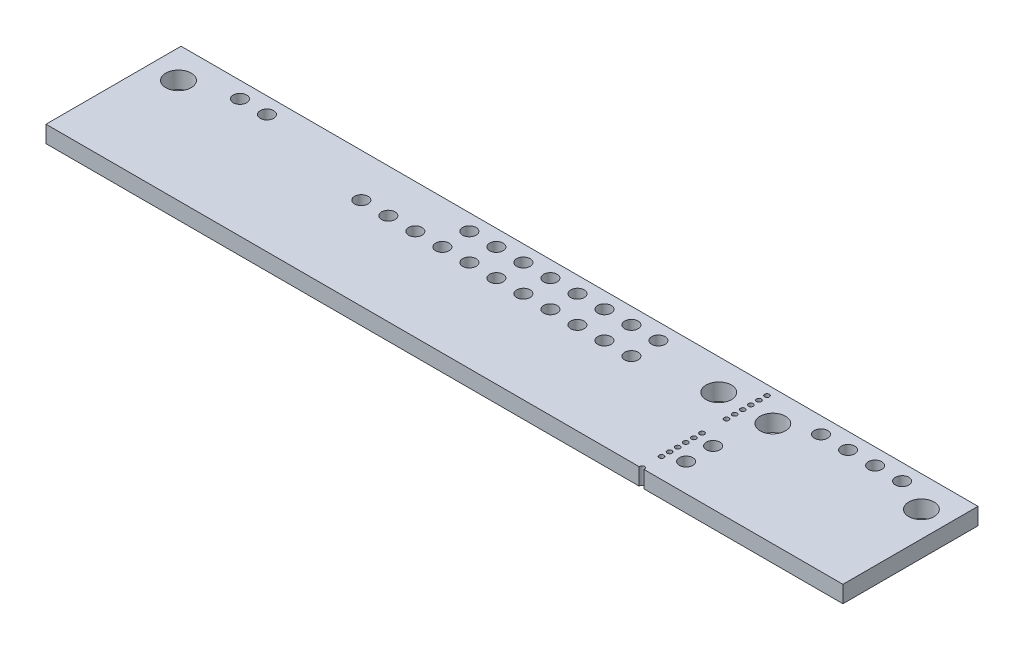
from build123d import *

# Parameters (mm, degrees)
SKETCH1_W           = 74.93
SKETCH1_H           = 12.7
BOSS_EXTRUDE1_DEPTH = 1.5875
CUT_EXTRUDE1_REACH  = 136.341
SKETCH2_R           = 1.1938
BOSS_EXTRUDE2_DEPTH = 1.6
SKETCH4_W           = 2.159
SKETCH4_H           = 1.27
CUT_EXTRUDE2_DEPTH  = 0.4
BOSS_EXTRUDE3_DEPTH = 3.4
SKETCH7_W           = 1.628437349
SKETCH7_H           = 1.286712751
SKETCH7_W_2         = 1.879951672
SKETCH7_H_2         = 1.278378213
SKETCH7_H_3         = 0.900698925
SKETCH7_H_4         = 1.3
CUT_EXTRUDE3_DEPTH  = 135.340813795
LPATTERN1_COUNT     = 8
LPATTERN1_PITCH     = 9.525
SKETCH8_R           = 0.63325759
SKETCH8_R_2         = 0.224218381
CUT_EXTRUDE4_DEPTH  = 1.5875


with BuildPart() as part:
    # Sketch1 → Boss-Extrude1 (new body)
    with BuildSketch(Plane(origin=(0, 0, 0), x_dir=(1, 0, 0), z_dir=(0, 1, 0))):
        with Locations((-95.31688982, 13.993647339)):
            Rectangle(SKETCH1_W, SKETCH1_H)
    extrude(amount=BOSS_EXTRUDE1_DEPTH)

    # Sketch2 → Cut-Extrude1 (cut, up to next)
    with BuildSketch(Plane(origin=(0, 1.5875, 0), x_dir=(1, 0, 0), z_dir=(0, 1, 0)), mode=Mode.PRIVATE) as cut_extrude1_sk1:
        with Locations(Location((-130.119440394, 17.438350152, 0), (0, 0, 270))):
            Circle(SKETCH2_R)
    cut_extrude1_tool1 = extrude(cut_extrude1_sk1.sketch, amount=-CUT_EXTRUDE1_REACH, mode=Mode.PRIVATE) & part.part
    # Sketch2 → Cut-Extrude1 (cut, up to next)
    with BuildSketch(Plane(origin=(0, 1.5875, 0), x_dir=(1, 0, 0), z_dir=(0, 1, 0)), mode=Mode.PRIVATE) as cut_extrude1_sk2:
        with Locations(Location((-79.319440394, 17.438350152, 0), (0, 0, 270))):
            Circle(SKETCH2_R)
    cut_extrude1_tool2 = extrude(cut_extrude1_sk2.sketch, amount=-CUT_EXTRUDE1_REACH, mode=Mode.PRIVATE) & part.part
    # Sketch2 → Cut-Extrude1 (cut, up to next)
    with BuildSketch(Plane(origin=(0, 1.5875, 0), x_dir=(1, 0, 0), z_dir=(0, 1, 0)), mode=Mode.PRIVATE) as cut_extrude1_sk3:
        with Locations(Location((-74.239440394, 17.438350152, 0), (0, 0, 270))):
            Circle(SKETCH2_R)
    cut_extrude1_tool3 = extrude(cut_extrude1_sk3.sketch, amount=-CUT_EXTRUDE1_REACH, mode=Mode.PRIVATE) & part.part
    # Sketch2 → Cut-Extrude1 (cut, up to next)
    with BuildSketch(Plane(origin=(0, 1.5875, 0), x_dir=(1, 0, 0), z_dir=(0, 1, 0)), mode=Mode.PRIVATE) as cut_extrude1_sk4:
        with Locations(Location((-60.269440394, 17.438350152, 0), (0, 0, 270))):
            Circle(SKETCH2_R)
    cut_extrude1_tool4 = extrude(cut_extrude1_sk4.sketch, amount=-CUT_EXTRUDE1_REACH, mode=Mode.PRIVATE) & part.part
    add(cut_extrude1_tool1.solids().sort_by_distance((-130.11944, 1.5875, -17.43835))[0], mode=Mode.SUBTRACT)
    add(cut_extrude1_tool2.solids().sort_by_distance((-79.31944, 1.5875, -17.43835))[0], mode=Mode.SUBTRACT)
    add(cut_extrude1_tool3.solids().sort_by_distance((-74.23944, 1.5875, -17.43835))[0], mode=Mode.SUBTRACT)
    add(cut_extrude1_tool4.solids().sort_by_distance((-60.26944, 1.5875, -17.43835))[0], mode=Mode.SUBTRACT)

    # Sketch3 → Boss-Extrude2 (add)
    with BuildSketch(Plane.XZ):
        Polygon((-127.911953378, -9.436207352), (-127.411953378, -9.936207352), (-127.411953378, -12.836207352), (-130.111953378, -12.836207352), (-130.111953378, -9.436207352), align=None)
    boss_extrude2 = extrude(amount=BOSS_EXTRUDE2_DEPTH)

    # Sketch4 → Cut-Extrude2 (cut)
    with BuildSketch(Plane.XZ.offset(1.6)):
        Polygon((-127.937602017, -9.74120725), (-127.683602017, -9.99520725), (-127.683602017, -11.01120725), (-129.842602017, -11.01120725), (-129.842602017, -9.74120725), align=None)
        with Locations((-128.763102017, -11.896207454)):
            Rectangle(SKETCH4_W, SKETCH4_H)
    cut_extrude2 = extrude(amount=-CUT_EXTRUDE2_DEPTH, mode=Mode.SUBTRACT)

    # Sketch5 → Boss-Extrude3 (add)
    with BuildSketch(Plane(origin=(0, 0, -12.836207352), x_dir=(-1, 0, 0), z_dir=(0, 0, -1))):
        Polygon((130.111953378, -0.702294734), (130.327423432, -0.702294734), (130.617423432, -0.2), (131.111953378, -0.2), (131.111953378, 0), (130.501953378, 0), (130.211953378, -0.502294734), (130.111953378, -0.502294734), align=None)
        Polygon((127.411953378, -0.502294734), (127.411953378, -0.702294734), (127.196483324, -0.702294734), (126.906483324, -0.2), (126.411953378, -0.2), (126.411953378, 0), (127.021953378, 0), (127.311953378, -0.502294734), align=None)
    boss_extrude3 = extrude(amount=-BOSS_EXTRUDE3_DEPTH)

    # Sketch7 → Cut-Extrude3 (cut, through all)
    with BuildSketch(Plane.XZ):
        with Locations((-130.926172053, -9.300850977)):
            Rectangle(SKETCH7_W, SKETCH7_H)
        with Locations((-126.471977542, -9.305018246)):
            Rectangle(SKETCH7_W_2, SKETCH7_H_2)
        with Locations((-130.926172053, -12.694556815)):
            Rectangle(SKETCH7_W, SKETCH7_H_3)
        with Locations((-126.471977542, -12.694556815)):
            Rectangle(SKETCH7_W_2, SKETCH7_H_3)
        with Locations((-130.926172053, -11.094207352)):
            Rectangle(SKETCH7_W, SKETCH7_H_4)
        with Locations((-126.471977542, -11.094207352)):
            Rectangle(SKETCH7_W_2, SKETCH7_H_4)
    cut_extrude3 = extrude(amount=CUT_EXTRUDE3_DEPTH, mode=Mode.SUBTRACT)

    # LPattern1: Boss-Extrude2, Cut-Extrude2, Boss-Extrude3, Cut-Extrude3 ×8
    with Locations(*[(i * LPATTERN1_PITCH, 0, 0) for i in range(1, LPATTERN1_COUNT)]):
        add(boss_extrude2)
        add(cut_extrude2, mode=Mode.SUBTRACT)
        add(boss_extrude3)
        add(cut_extrude3, mode=Mode.SUBTRACT)

    # Sketch8 → Cut-Extrude4 (cut)
    with BuildSketch(Plane(origin=(0, 1.5875, 0), x_dir=(1, 0, 0), z_dir=(0, 1, 0))):
        with Locations(Location((-111.775884627, 16.283303593, 0), (0, 0, 270))):
            Circle(SKETCH8_R)
        with Locations(Location((-109.235884627, 16.283303593, 0), (0, 0, 270))):
            Circle(SKETCH8_R)
        with Locations(Location((-106.695884627, 16.283303593, 0), (0, 0, 270))):
            Circle(SKETCH8_R)
        with Locations(Location((-104.155884627, 16.283303593, 0), (0, 0, 270))):
            Circle(SKETCH8_R)
        with Locations(Location((-101.615884627, 16.283303593, 0), (0, 0, 270))):
            Circle(SKETCH8_R)
        with Locations(Location((-99.075884627, 16.283303593, 0), (0, 0, 270))):
            Circle(SKETCH8_R)
        with Locations(Location((-96.535884627, 16.283303593, 0), (0, 0, 270))):
            Circle(SKETCH8_R)
        with Locations(Location((-93.995884627, 16.283303593, 0), (0, 0, 270))):
            Circle(SKETCH8_R)
        with Locations(Location((-91.455884627, 16.283303593, 0), (0, 0, 270))):
            Circle(SKETCH8_R)
        with Locations(Location((-88.915884627, 16.283303593, 0), (0, 0, 270))):
            Circle(SKETCH8_R)
        with Locations(Location((-86.375884627, 16.283303593, 0), (0, 0, 270))):
            Circle(SKETCH8_R)
        with Locations(Location((-104.155884627, 18.823303593, 0), (0, 0, 270))):
            Circle(SKETCH8_R)
        with Locations(Location((-101.615884627, 18.823303593, 0), (0, 0, 270))):
            Circle(SKETCH8_R)
        with Locations(Location((-99.075884627, 18.823303593, 0), (0, 0, 270))):
            Circle(SKETCH8_R)
        with Locations(Location((-96.535884627, 18.823303593, 0), (0, 0, 270))):
            Circle(SKETCH8_R)
        with Locations(Location((-93.995884627, 18.823303593, 0), (0, 0, 270))):
            Circle(SKETCH8_R)
        with Locations(Location((-91.455884627, 18.823303593, 0), (0, 0, 270))):
            Circle(SKETCH8_R)
        with Locations(Location((-88.915884627, 18.823303593, 0), (0, 0, 270))):
            Circle(SKETCH8_R)
        with Locations(Location((-86.375884627, 18.823303593, 0), (0, 0, 270))):
            Circle(SKETCH8_R)
        with Locations(Location((-71.090797582, 18.823303593, 0), (0, 0, 270))):
            Circle(SKETCH8_R)
        with Locations(Location((-68.550797582, 18.823303593, 0), (0, 0, 270))):
            Circle(SKETCH8_R)
        with Locations(Location((-66.010797582, 18.823303593, 0), (0, 0, 270))):
            Circle(SKETCH8_R)
        with Locations(Location((-63.470797582, 18.823303593, 0), (0, 0, 270))):
            Circle(SKETCH8_R)
        with Locations(Location((-125.72302472, 18.823303593, 0), (0, 0, 270))):
            Circle(SKETCH8_R)
        with Locations(Location((-123.18302472, 18.823303593, 0), (0, 0, 270))):
            Circle(SKETCH8_R)
        with Locations(Location((-75.218223012, 12.807784181, 0), (0, 0, 270))):
            Circle(SKETCH8_R)
        with Locations(Location((-75.218223012, 10.267784181, 0), (0, 0, 270))):
            Circle(SKETCH8_R)
        with Locations(Location((-76.786409082, 15.632493479, 0), (0, 0, 270))):
            Circle(SKETCH8_R_2)
        with Locations(Location((-76.786409082, 16.394493479, 0), (0, 0, 270))):
            Circle(SKETCH8_R_2)
        with Locations(Location((-76.786409082, 17.156493479, 0), (0, 0, 270))):
            Circle(SKETCH8_R_2)
        with Locations(Location((-76.786409082, 17.918493479, 0), (0, 0, 270))):
            Circle(SKETCH8_R_2)
        with Locations(Location((-76.786409082, 18.680493479, 0), (0, 0, 270))):
            Circle(SKETCH8_R_2)
        with Locations(Location((-76.786409082, 19.442493479, 0), (0, 0, 270))):
            Circle(SKETCH8_R_2)
        with Locations(Location((-76.786409082, 9.517262395, 0), (0, 0, 270))):
            Circle(SKETCH8_R_2)
        with Locations(Location((-76.786409082, 10.279262395, 0), (0, 0, 270))):
            Circle(SKETCH8_R_2)
        with Locations(Location((-76.786409082, 11.041262395, 0), (0, 0, 270))):
            Circle(SKETCH8_R_2)
        with Locations(Location((-76.786409082, 11.803262395, 0), (0, 0, 270))):
            Circle(SKETCH8_R_2)
        with Locations(Location((-76.786409082, 12.565262395, 0), (0, 0, 270))):
            Circle(SKETCH8_R_2)
        with Locations(Location((-76.786409082, 13.327262395, 0), (0, 0, 270))):
            Circle(SKETCH8_R_2)
        with Locations((-76.786409082, 7.696755231)):
            Circle(SKETCH8_R_2)
    extrude(amount=-CUT_EXTRUDE4_DEPTH, mode=Mode.SUBTRACT)


solid = part.part
